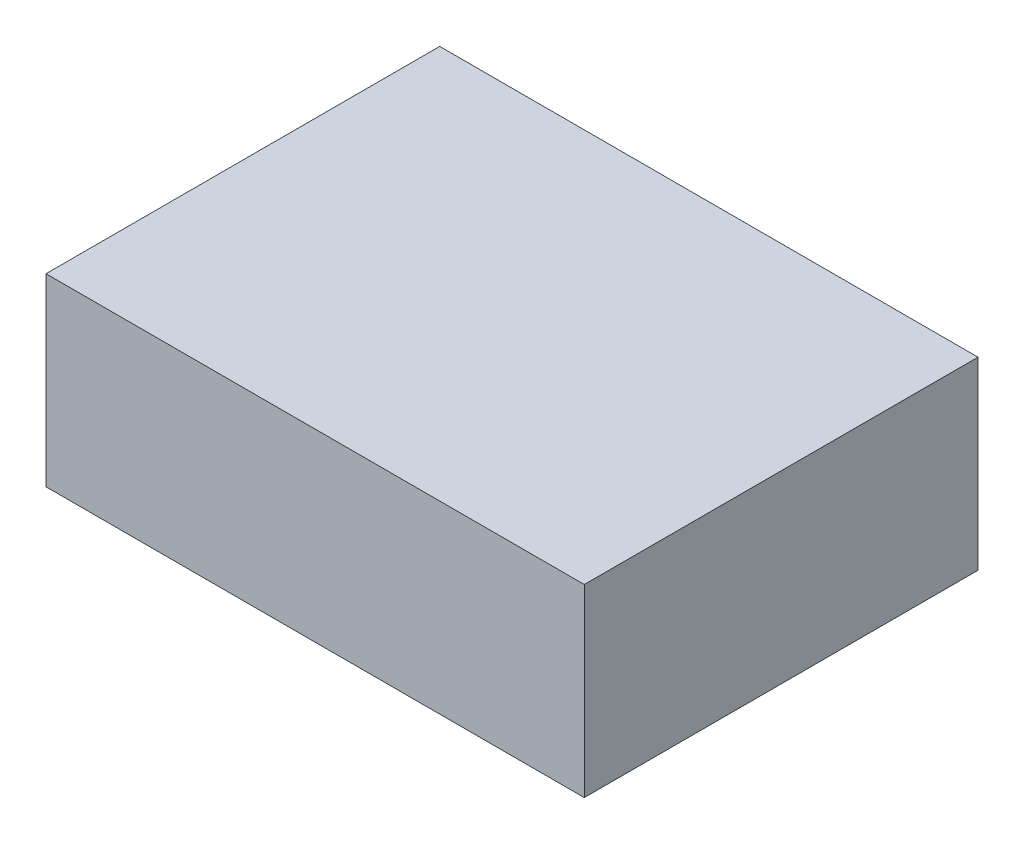
from build123d import *

# Parameters (mm, degrees)
SKETCH1_W           = 175
SKETCH1_H           = 128
BOSS_EXTRUDE1_DEPTH = 60


with BuildPart() as part:
    # Sketch1 → Boss-Extrude1 (new body)
    with BuildSketch(Plane(origin=(0, 0, 0), x_dir=(1, 0, 0), z_dir=(0, 1, 0))):
        Rectangle(SKETCH1_W, SKETCH1_H)
    extrude(amount=BOSS_EXTRUDE1_DEPTH)


solid = part.part
